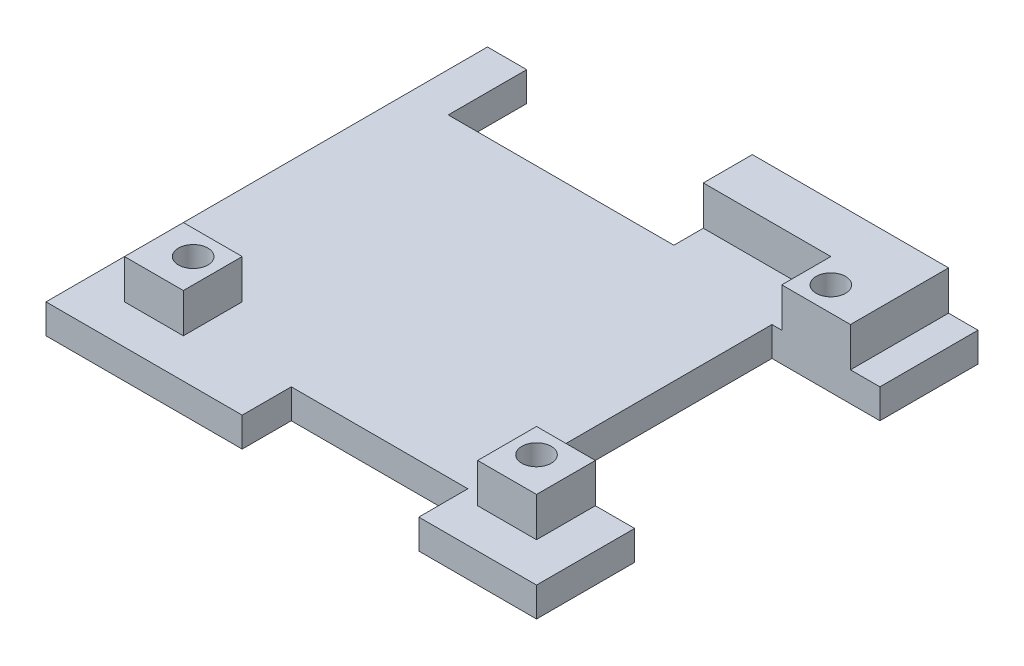
from build123d import *

# Parameters (mm, degrees)
SKETCH_1_W          = 50
SKETCH_1_H          = 45
EXTRUDE_1_DEPTH     = 3
SKETCH_2_W          = 6
SKETCH_2_H          = 6
EXTRUDE_2_DEPTH     = 4
SKETCH_4_W          = 23
SKETCH_4_H          = 8
SKETCH_4_W_2        = 11
SKETCH_4_H_2        = 25
SKETCH_4_W_3        = 18
SKETCH_4_H_3        = 5
CUT_EXTRUDE_1_DEPTH = 4
HOLE_WIZARD_1_D     = 3


with BuildPart() as part:
    # 草图1 → 凸台-拉伸1 (new body)
    with BuildSketch(Plane(origin=(0, 0, 0), x_dir=(1, 0, 0), z_dir=(0, 1, 0))):
        Rectangle(SKETCH_1_W, SKETCH_1_H)
    extrude(amount=EXTRUDE_1_DEPTH)

    # 草图2 → 凸台-拉伸2 (add)
    with BuildSketch(Plane(origin=(0, 3, 0), x_dir=(1, 0, 0), z_dir=(0, 1, 0))):
        Polygon((22, 22.5), (15, 22.5), (2, 22.5), (2, 17.5), (15, 17.5), (15, 12.5), (22, 12.5), align=None)
        with Locations((-18, -15.5)):
            Rectangle(SKETCH_2_W, SKETCH_2_H)
        with Locations((18, -15.5)):
            Rectangle(SKETCH_2_W, SKETCH_2_H)
    extrude(amount=EXTRUDE_2_DEPTH)

    # 草图4 → 切除-拉伸1 (cut)
    with BuildSketch(Plane(origin=(0, 3, 0), x_dir=(1, 0, 0), z_dir=(0, 1, 0))):
        with Locations((-9.5, 18.5)):
            Rectangle(SKETCH_4_W, SKETCH_4_H)
        with Locations((19.5, 0)):
            Rectangle(SKETCH_4_W_2, SKETCH_4_H_2)
        with Locations((4, -20)):
            Rectangle(SKETCH_4_W_3, SKETCH_4_H_3)
    extrude(amount=-CUT_EXTRUDE_1_DEPTH, mode=Mode.SUBTRACT)

    # 孔1 (through all)
    with Locations(Plane(origin=(-17.5, 7, 15), x_dir=(0, 0, 1), z_dir=(0, 1, 0))):
        with Locations((0, 0), (0, 35), (-30, 35)):
            Hole(HOLE_WIZARD_1_D / 2)


solid = part.part
